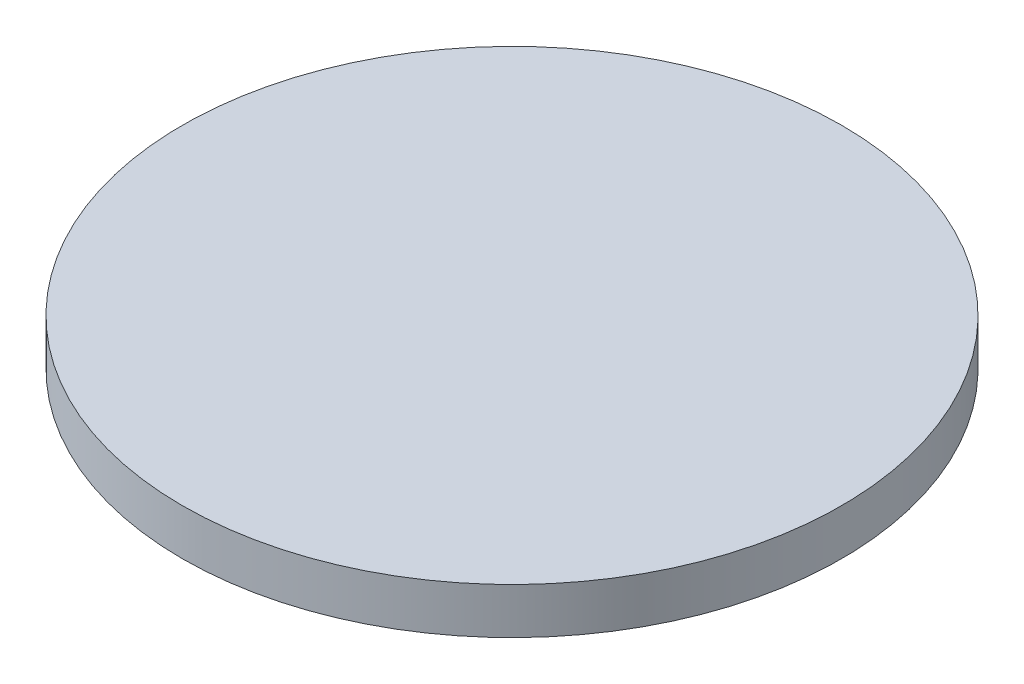
from build123d import *

# Parameters (mm, degrees)
SKETCH1_R           = 21.5
BOSS_EXTRUDE1_DEPTH = 3


with BuildPart() as part:
    # Sketch1 → Boss-Extrude1 (new body)
    with BuildSketch(Plane(origin=(0, 0, 0), x_dir=(1, 0, 0), z_dir=(0, 1, 0))):
        with Locations(Location((0, 0, 0), (0, 0, 270))):
            Circle(SKETCH1_R)
    extrude(amount=BOSS_EXTRUDE1_DEPTH)


solid = part.part
